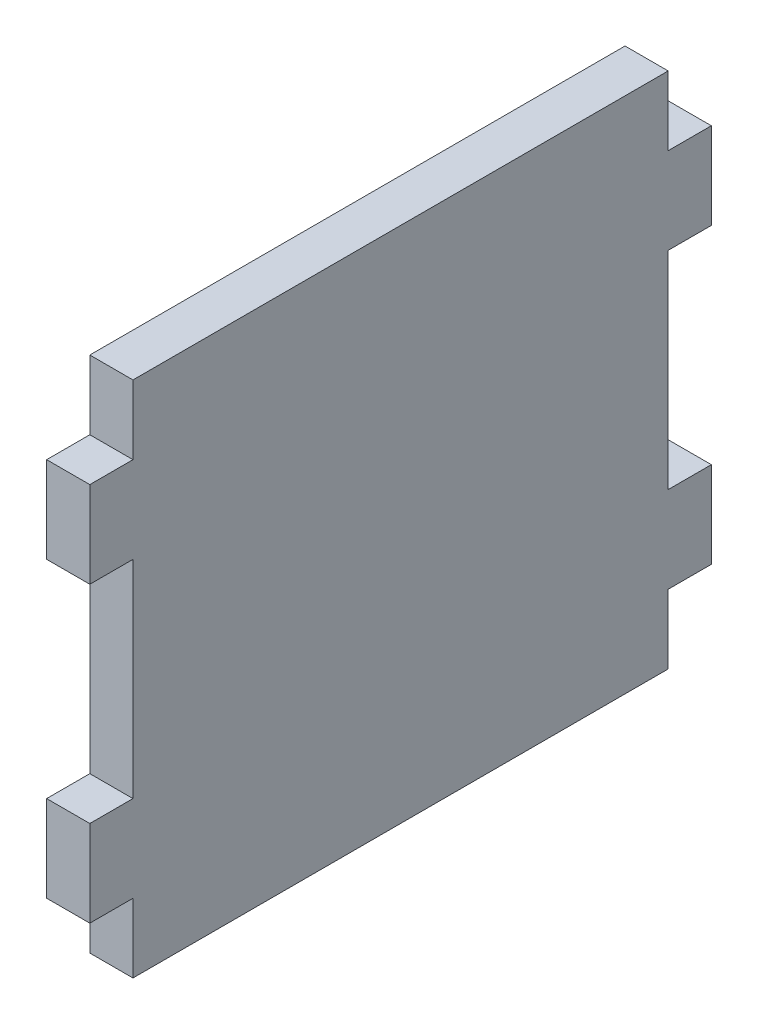
from build123d import *

# Parameters (mm, degrees)
BOSS_EXTRUDE1_DEPTH = 5


with BuildPart() as part:
    # Sketch1 → Boss-Extrude1 (new body)
    with BuildSketch(Plane.YZ):
        Polygon((-30, -28), (-30, 28), (-22, 28), (-22, 33), (-12, 33), (-12, 28), (12, 28), (12, 33), (22, 33), (22, 28), (30, 28), (30, -28), (30, -34), (22, -34), (22, -39), (12, -39), (12, -34), (-12, -34), (-12, -39), (-22, -39), (-22, -34), (-30, -34), align=None)
    extrude(amount=BOSS_EXTRUDE1_DEPTH)


solid = part.part
